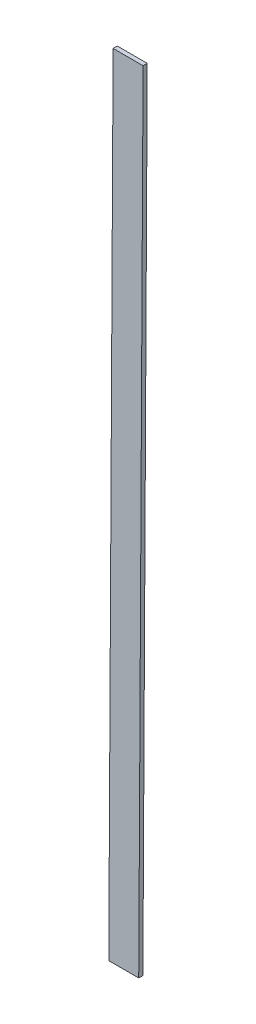
from build123d import *

# Parameters (mm, degrees)
BOSS_EXTRUDE1_DEPTH = 1.5875


with BuildPart() as part:
    # Sketch1 → Boss-Extrude1 (new body)
    with BuildSketch(Plane.XY):
        Polygon((14.629204605, -88.360768306), (16.294422033, 213.906354793), (27.728340931, 213.906354793), (26.063117095, -88.360768306), align=None)
    extrude(amount=BOSS_EXTRUDE1_DEPTH)


solid = part.part
